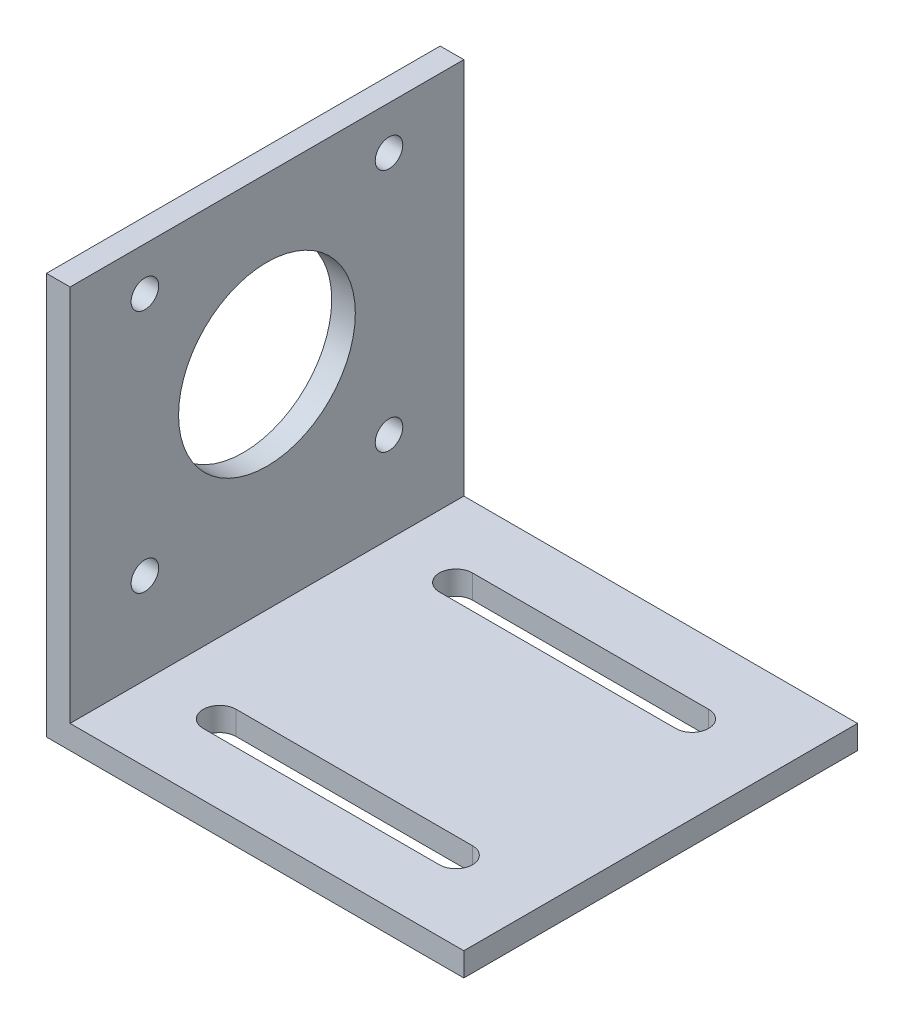
from build123d import *

# Parameters (mm, degrees)
EXTRUDE_1_DEPTH     = 50
SKETCH_3_R          = 11.223257521
SKETCH_3_R_2        = 1.75
CUT_EXTRUDE_1_DEPTH = 76.168144849
CUT_EXTRUDE_2_DEPTH = 75.204110398


with BuildPart() as part:
    # 草图2 → 凸台-拉伸1 (new body)
    with BuildSketch(Plane.XY):
        Polygon((-23.5, 25.5), (-23.5, -22.5), (26.5, -22.5), (26.5, -25.5), (-26.5, -25.5), (-26.5, 25.5), align=None)
    extrude(amount=EXTRUDE_1_DEPTH)

    # 草图3 → 切除-拉伸1 (cut, through all)
    with BuildSketch(Plane(origin=(-23.5, 0, 0), x_dir=(0, 0, -1), z_dir=(1, 0, 0))):
        with Locations(Location((-25, 4.5, 0), (0, 0, 90))):
            Circle(SKETCH_3_R)
        with Locations(Location((-40.5, 20, 0), (0, 0, 90))):
            Circle(SKETCH_3_R_2)
        with Locations(Location((-9.5, 20, 0), (0, 0, 90))):
            Circle(SKETCH_3_R_2)
        with Locations(Location((-9.5, -11, 0), (0, 0, 90))):
            Circle(SKETCH_3_R_2)
        with Locations(Location((-40.5, -11, 0), (0, 0, 90))):
            Circle(SKETCH_3_R_2)
    extrude(amount=-CUT_EXTRUDE_1_DEPTH, mode=Mode.SUBTRACT)

    # 草图4 → 切除-拉伸2 (cut, through all)
    with BuildSketch(Plane(origin=(0, -22.5, 0), x_dir=(1, 0, 0), z_dir=(0, 1, 0))):
        with BuildLine():
            Line((-14.5, -7.9), (15.5, -7.9))
            ThreePointArc((15.5, -7.9), (17.6, -10), (15.5, -12.1))
            Line((15.5, -12.1), (-14.5, -12.1))
            ThreePointArc((-14.5, -12.1), (-16.6, -10), (-14.5, -7.9))
        make_face()
        with BuildLine():
            Line((15.5, -37.9), (-14.5, -37.9))
            ThreePointArc((-14.5, -37.9), (-16.6, -40), (-14.5, -42.1))
            Line((-14.5, -42.1), (15.5, -42.1))
            ThreePointArc((15.5, -42.1), (17.6, -40), (15.5, -37.9))
        make_face()
    extrude(amount=-CUT_EXTRUDE_2_DEPTH, mode=Mode.SUBTRACT)


solid = part.part
